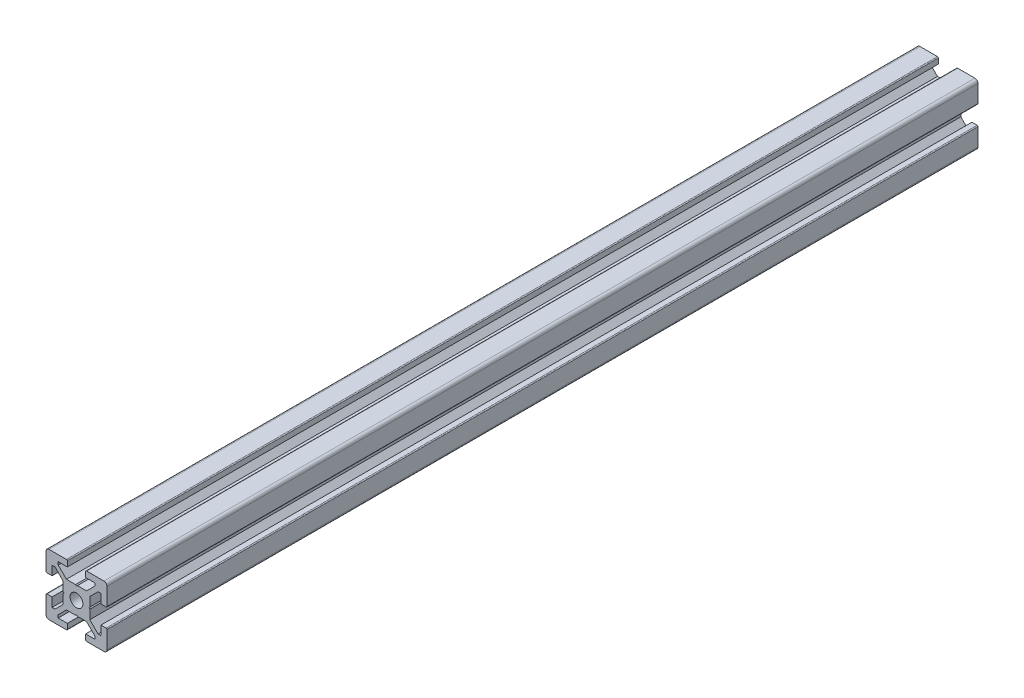
from build123d import *

# Parameters (mm, degrees)
SKETCH1_R           = 2.1
BOSS_EXTRUDE1_DEPTH = 285.550937794


with BuildPart() as part:
    # Sketch1 → Boss-Extrude1 (new body)
    with BuildSketch(Plane.XY):
        with BuildLine():
            Line((3.3, 4.360660172), (6.000039828, 7.0607))
            Line((6.000039828, 7.0607), (6.000039828, 8))
            Line((6.000039828, 8), (3.000039828, 8))
            Line((3.000039828, 8), (3.000039828, 9.7))
            ThreePointArc((3.000039828, 9.7), (3.087907794, 9.912132034), (3.300039828, 10))
            Line((3.300039828, 10), (9, 10))
            ThreePointArc((9, 10), (9.707106781, 9.707106781), (10, 9))
            Line((10, 9), (10, 3.300039828))
            ThreePointArc((10, 3.300039828), (9.912132034, 3.087907794), (9.7, 3.000039828))
            Line((9.7, 3.000039828), (8, 3.000039828))
            Line((8, 3.000039828), (8, 6.000039828))
            Line((8, 6.000039828), (7.0607, 6.000039828))
            Line((7.0607, 6.000039828), (4.360660172, 3.3))
            Line((4.360660172, 3.3), (4.360660172, 0.3))
            Line((4.360660172, 0.3), (4.060660172, 0))
            Line((4.060660172, 0), (4.360660172, -0.3))
            Line((4.360660172, -0.3), (4.360660172, -3.3))
            Line((4.360660172, -3.3), (7.0607, -6.000039828))
            Line((7.0607, -6.000039828), (8, -6.000039828))
            Line((8, -6.000039828), (8, -3.000039828))
            Line((8, -3.000039828), (9.7, -3.000039828))
            ThreePointArc((9.7, -3.000039828), (9.912132034, -3.087907794), (10, -3.300039828))
            Line((10, -3.300039828), (10, -9))
            ThreePointArc((10, -9), (9.707106781, -9.707106781), (9, -10))
            Line((9, -10), (3.300039828, -10))
            ThreePointArc((3.300039828, -10), (3.087907794, -9.912132034), (3.000039828, -9.7))
            Line((3.000039828, -9.7), (3.000039828, -8))
            Line((3.000039828, -8), (6.000039828, -8))
            Line((6.000039828, -8), (6.000039828, -7.0607))
            Line((6.000039828, -7.0607), (3.3, -4.360660172))
            Line((3.3, -4.360660172), (0.3, -4.360660172))
            Line((0.3, -4.360660172), (0, -4.060660172))
            Line((0, -4.060660172), (-0.3, -4.360660172))
            Line((-0.3, -4.360660172), (-3.3, -4.360660172))
            Line((-3.3, -4.360660172), (-6.000039828, -7.0607))
            Line((-6.000039828, -7.0607), (-6.000039828, -8))
            Line((-6.000039828, -8), (-3.000039828, -8))
            Line((-3.000039828, -8), (-3.000039828, -9.7))
            ThreePointArc((-3.000039828, -9.7), (-3.087907794, -9.912132034), (-3.300039828, -10))
            Line((-3.300039828, -10), (-9, -10))
            ThreePointArc((-9, -10), (-9.707106781, -9.707106781), (-10, -9))
            Line((-10, -9), (-10, -3.300039828))
            ThreePointArc((-10, -3.300039828), (-9.912132034, -3.087907794), (-9.7, -3.000039828))
            Line((-9.7, -3.000039828), (-8, -3.000039828))
            Line((-8, -3.000039828), (-8, -6.000039828))
            Line((-8, -6.000039828), (-7.0607, -6.000039828))
            Line((-7.0607, -6.000039828), (-4.360660172, -3.3))
            Line((-4.360660172, -3.3), (-4.360660172, -0.3))
            Line((-4.360660172, -0.3), (-4.060660172, 0))
            Line((-4.060660172, 0), (-4.360660172, 0.3))
            Line((-4.360660172, 0.3), (-4.360660172, 3.3))
            Line((-4.360660172, 3.3), (-7.0607, 6.000039828))
            Line((-7.0607, 6.000039828), (-8, 6.000039828))
            Line((-8, 6.000039828), (-8, 3.000039828))
            Line((-8, 3.000039828), (-9.7, 3.000039828))
            ThreePointArc((-9.7, 3.000039828), (-9.912132034, 3.087907794), (-10, 3.300039828))
            Line((-10, 3.300039828), (-10, 9))
            ThreePointArc((-10, 9), (-9.707106781, 9.707106781), (-9, 10))
            Line((-9, 10), (-3.300039828, 10))
            ThreePointArc((-3.300039828, 10), (-3.087907794, 9.912132034), (-3.000039828, 9.7))
            Line((-3.000039828, 9.7), (-3.000039828, 8))
            Line((-3.000039828, 8), (-6.000039828, 8))
            Line((-6.000039828, 8), (-6.000039828, 7.0607))
            Line((-6.000039828, 7.0607), (-3.3, 4.360660172))
            Line((-3.3, 4.360660172), (-0.3, 4.360660172))
            Line((-0.3, 4.360660172), (0, 4.060660172))
            Line((0, 4.060660172), (0.3, 4.360660172))
            Line((0.3, 4.360660172), (3.3, 4.360660172))
        make_face()
        with Locations(Location((0, 0, 0), (0, 0, 90))):
            Circle(SKETCH1_R, mode=Mode.SUBTRACT)
    extrude(amount=BOSS_EXTRUDE1_DEPTH)


solid = part.part
